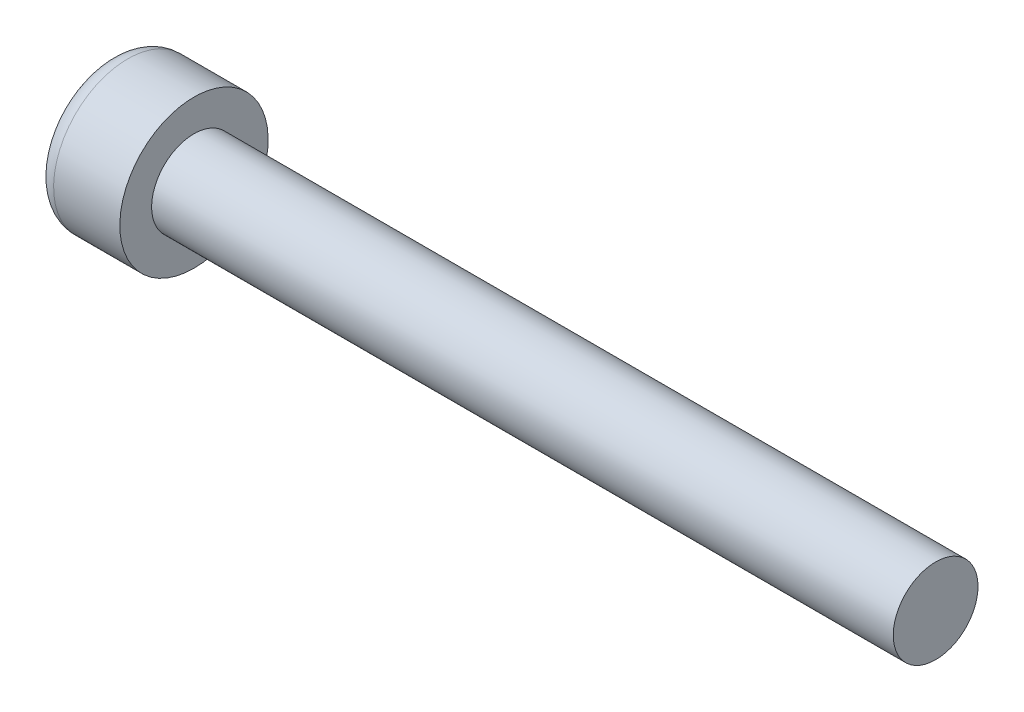
from build123d import *

# Parameters (mm, degrees)
CUT_EXTRUDE1_DEPTH = 2


with BuildPart() as part:
    # Sketch1 → Revolve1 (revolve)
    with BuildSketch(Plane.XY, mode=Mode.PRIVATE) as revolve1_sk:
        with BuildLine():
            Line((0, 0), (0, 2.625))
            ThreePointArc((0, 2.625), (0.256281566, 3.243718434), (0.875, 3.5))
            Line((0.875, 3.5), (4, 3.5))
            Line((4, 3.5), (4, 2))
            Line((4, 2), (39, 2))
            Line((39, 2), (39, 0))
            Line((39, 0), (0, 0))
        make_face()
    revolve(revolve1_sk.sketch.rotate(Axis((0, 0, 0), (1, 0, 0)), 180), axis=Axis((0, 0, 0), (1, 0, 0)))

    # Sketch2 → Cut-Extrude1 (cut)
    with BuildSketch(Plane.ZY):
        Polygon((0, 1.732050808), (-1.5, 0.866025404), (-1.5, -0.866025404), (0, -1.732050808), (1.5, -0.866025404), (1.5, 0.866025404), align=None)
    extrude(amount=-CUT_EXTRUDE1_DEPTH, mode=Mode.SUBTRACT)


solid = part.part
